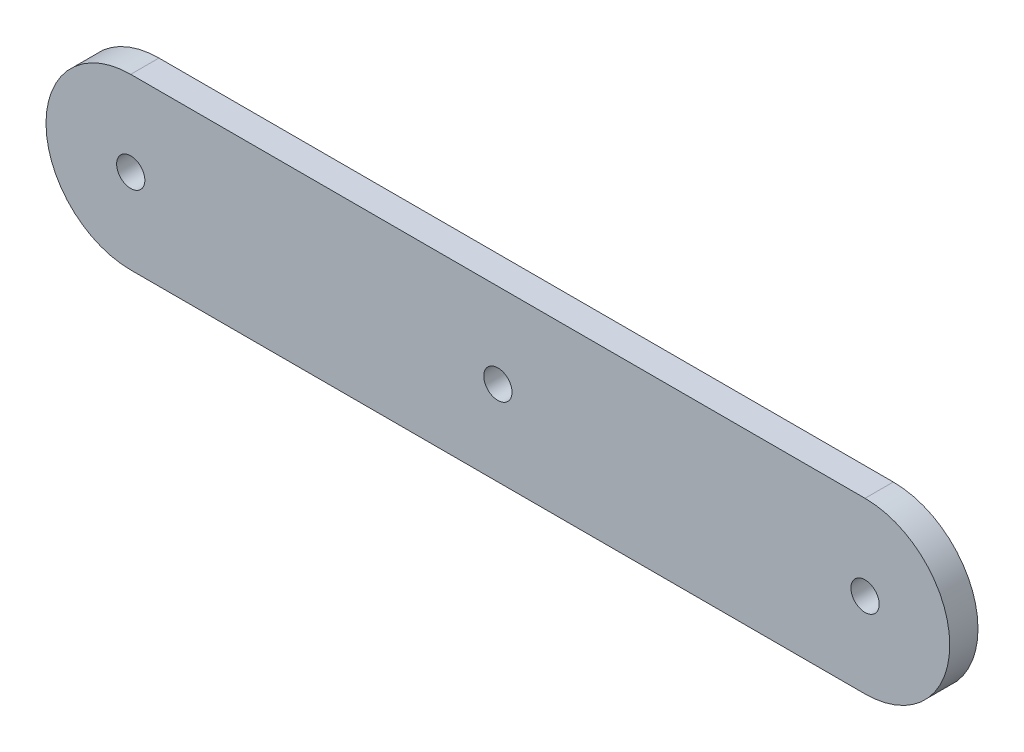
from build123d import *

# Parameters (mm, degrees)
SKETCH1_R           = 2.5
BOSS_EXTRUDE1_DEPTH = 5
SKETCH2_R           = 2.5
CUT_EXTRUDE1_DEPTH  = 5


with BuildPart() as part:
    # Sketch1 → Boss-Extrude1 (new body)
    with BuildSketch(Plane.XY):
        with BuildLine():
            Line((-67.024818312, 37.285306338), (62.975181688, 37.285306338))
            ThreePointArc((62.975181688, 37.285306338), (77.975181688, 22.285306338), (62.975181688, 7.285306338))
            Line((62.975181688, 7.285306338), (-67.024818312, 7.285306338))
            ThreePointArc((-67.024818312, 7.285306338), (-82.024818312, 22.285306338), (-67.024818312, 37.285306338))
        make_face()
        with Locations((-67.024818312, 22.285306338)):
            Circle(SKETCH1_R, mode=Mode.SUBTRACT)
        with Locations((62.975181688, 22.285306338)):
            Circle(SKETCH1_R, mode=Mode.SUBTRACT)
    extrude(amount=BOSS_EXTRUDE1_DEPTH)

    # Sketch2 → Cut-Extrude1 (cut)
    with BuildSketch(Plane(origin=(0, 0, 0), x_dir=(-1, 0, 0), z_dir=(0, 0, -1))):
        with Locations((2.024818312, 22.285306338)):
            Circle(SKETCH2_R)
    extrude(amount=-CUT_EXTRUDE1_DEPTH, mode=Mode.SUBTRACT)


solid = part.part
